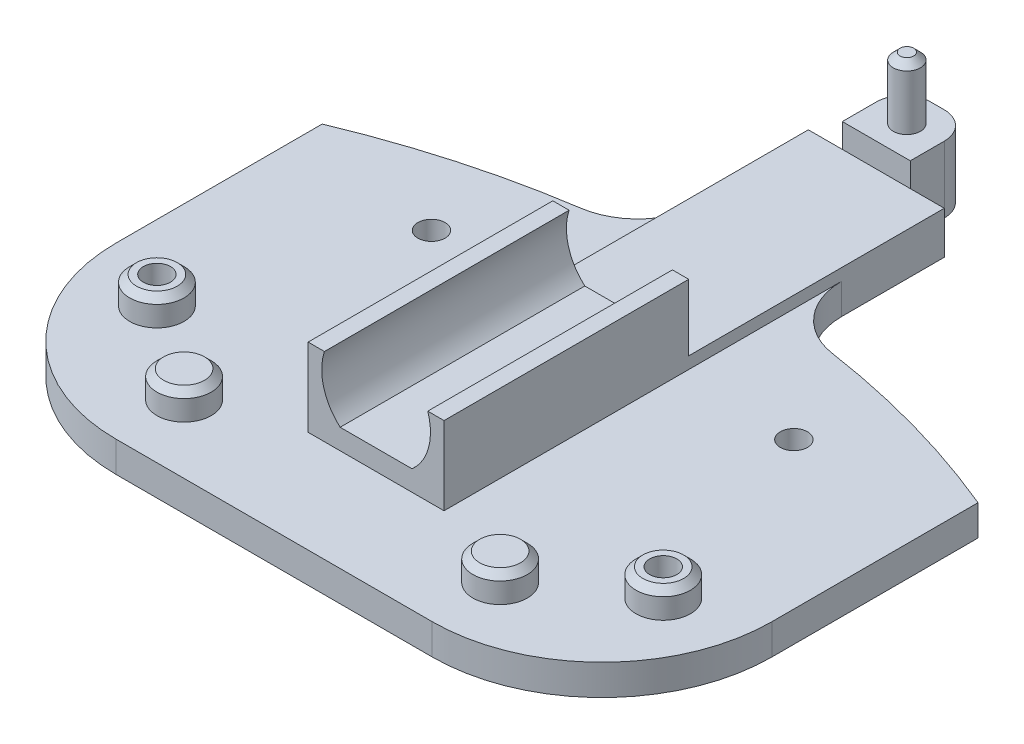
from build123d import *

# Parameters (mm, degrees)
SKETCH1_W           = 96.5
SKETCH1_H           = 110
BOSS_EXTRUDE1_DEPTH = 4.5
SKETCH2_R           = 4
BOSS_EXTRUDE2_DEPTH = 4
SKETCH3_R           = 2
BOSS_EXTRUDE3_DEPTH = 14.4
SKETCH4_W           = 20
SKETCH4_H           = 37.6
BOSS_EXTRUDE4_DEPTH = 1.75
BOSS_EXTRUDE5_DEPTH = 11.5
BOSS_EXTRUDE6_DEPTH = 5.3
CHAMFER2_SIZE       = 1
CUT_EXTRUDE6_DEPTH  = 115.67545509
CHAMFER3_SIZE       = 1
SKETCH2_4_R         = 4
BOSS_EXTRUDE8_DEPTH = 4
CUT_EXTRUDE10_DEPTH = 148.036084007
FILLET1_R           = 10
SKETCH21_R          = 2
CUT_EXTRUDE11_DEPTH = 148.036084007
CHAMFER4_SIZE       = 1
SKETCH22_R          = 2
CUT_EXTRUDE12_DEPTH = 147.698363999
FILLET2_R           = 25


with BuildPart() as part:
    # Sketch1 → Boss-Extrude1 (new body)
    with BuildSketch(Plane(origin=(0, 0, 0), x_dir=(1, 0, 0), z_dir=(0, 1, 0))):
        with Locations((48.25, -55)):
            Rectangle(SKETCH1_W, SKETCH1_H)
    extrude(amount=BOSS_EXTRUDE1_DEPTH)

    # Sketch2 → Boss-Extrude2 (add)
    with BuildSketch(Plane(origin=(0, 4.5, 0), x_dir=(1, 0, 0), z_dir=(0, 1, 0))):
        with Locations(Location((25, -100, 0), (0, 0, 270))):
            Circle(SKETCH2_R)
        with Locations(Location((71.5, -100, 0), (0, 0, 270))):
            Circle(SKETCH2_R)
    extrude(amount=BOSS_EXTRUDE2_DEPTH)

    # Sketch3 → Boss-Extrude3 (add)
    with BuildSketch(Plane(origin=(0, 4.5, 0), x_dir=(1, 0, 0), z_dir=(0, 1, 0))):
        with Locations(Location((48.25, -16.9, 0), (0, 0, 270))):
            Circle(SKETCH3_R)
    extrude(amount=BOSS_EXTRUDE3_DEPTH)

    # Sketch4 → Boss-Extrude4 (add)
    with BuildSketch(Plane(origin=(0, 4.5, 0), x_dir=(1, 0, 0), z_dir=(0, 1, 0))):
        with Locations((48.25, -40.2)):
            Rectangle(SKETCH4_W, SKETCH4_H)
    extrude(amount=BOSS_EXTRUDE4_DEPTH)

    # Sketch4<3> → Boss-Extrude5 (add)
    with BuildSketch(Plane(origin=(0, 4.5, 0), x_dir=(1, 0, 0), z_dir=(0, 1, 0))):
        Polygon((58.25, -59), (58.25, -95), (38.25, -95), (38.25, -59), (48.25, -59), align=None)
    extrude(amount=BOSS_EXTRUDE5_DEPTH)

    # Sketch4<5> → Boss-Extrude6 (add)
    with BuildSketch(Plane(origin=(0, 4.5, 0), x_dir=(1, 0, 0), z_dir=(0, 1, 0))):
        with BuildLine():
            Line((49.25, -12.4), (47.25, -12.4))
            ThreePointArc((47.25, -12.4), (44.421572875, -13.571572875), (43.25, -16.4))
            Line((43.25, -16.4), (43.25, -21.4))
            Line((43.25, -21.4), (53.25, -21.4))
            Line((53.25, -21.4), (53.25, -16.4))
            ThreePointArc((53.25, -16.4), (52.078427125, -13.571572875), (49.25, -12.4))
        make_face()
    extrude(amount=BOSS_EXTRUDE6_DEPTH)

    # Chamfer2
    chamfer2_edges = [part.edges().sort_by_distance(p)[0] for p in [
        (48.25, 18.9, 14.9),
    ]]
    chamfer(chamfer2_edges, length=CHAMFER2_SIZE)

    # Sketch9 → Cut-Extrude6 (cut, through all)
    with BuildSketch(Plane(origin=(0, 0, 59), x_dir=(-1, 0, 0), z_dir=(0, 0, -1))):
        with BuildLine():
            ThreePointArc((-55.849342077, 16), (-55.970490222, 11.403805654), (-53.541502622, 7.5))
            Line((-53.541502622, 7.5), (-42.958497378, 7.5))
            ThreePointArc((-42.958497378, 7.5), (-40.958497378, 10.208497378), (-40.25, 13.5))
            ThreePointArc((-40.25, 13.5), (-40.350799515, 14.765950905), (-40.650657923, 16))
            Line((-40.650657923, 16), (-55.849342077, 16))
        make_face()
    extrude(amount=-CUT_EXTRUDE6_DEPTH, mode=Mode.SUBTRACT)

    # Chamfer3
    chamfer3_edges = [part.edges().sort_by_distance(p)[0] for p in [
        (25, 8.5, 96),
        (71.5, 8.5, 96),
    ]]
    chamfer(chamfer3_edges, length=CHAMFER3_SIZE)

    # Sketch2<4> → Boss-Extrude8 (add)
    with BuildSketch(Plane(origin=(0, 4.5, 0), x_dir=(1, 0, 0), z_dir=(0, 1, 0))):
        with Locations(Location((11, -90, 0), (0, 0, 270))):
            Circle(SKETCH2_4_R)
        with Locations(Location((85.5, -90, 0), (0, 0, 270))):
            Circle(SKETCH2_4_R)
    extrude(amount=BOSS_EXTRUDE8_DEPTH)

    # Sketch20 → Cut-Extrude10 (cut, through all)
    with BuildSketch(Plane(origin=(0, 4.5, 0), x_dir=(1, 0, 0), z_dir=(0, 1, 0))):
        with BuildLine():
            Line((0, 0), (96.5, 0))
            Line((96.5, 0), (96.5, -54.687652439))
            ThreePointArc((96.5, -54.687652439), (77.742842614, -48.529130099), (58.25, -45.400642056))
            Line((58.25, -45.400642056), (58.25, -21.4))
            Line((58.25, -21.4), (53.25, -21.4))
            Line((53.25, -21.4), (53.25, -16.4))
            ThreePointArc((53.25, -16.4), (52.078427125, -13.571572875), (49.25, -12.4))
            Line((49.25, -12.4), (47.25, -12.4))
            ThreePointArc((47.25, -12.4), (44.421572875, -13.571572875), (43.25, -16.4))
            Line((43.25, -16.4), (43.25, -21.4))
            Line((43.25, -21.4), (38.25, -21.4))
            Line((38.25, -21.4), (38.25, -45.400642056))
            ThreePointArc((38.25, -45.400642056), (18.757157386, -48.529130099), (0, -54.687652439))
            Line((0, -54.687652439), (0, 0))
        make_face()
    extrude(amount=-CUT_EXTRUDE10_DEPTH, mode=Mode.SUBTRACT)

    # Fillet1
    fillet1_edges = [part.edges().sort_by_distance(p)[0] for p in [
        (58.25, 2.25, 45.400642056),
        (38.25, 2.25, 45.400642056),
    ]]
    fillet(fillet1_edges, radius=FILLET1_R)

    # Sketch21 → Cut-Extrude11 (cut, through all)
    with BuildSketch(Plane(origin=(0, 4.5, 0), x_dir=(1, 0, 0), z_dir=(0, 1, 0))):
        with Locations(Location((21.588470277, -60.190333609, 0), (0, 0, 270))):
            Circle(SKETCH21_R)
        with Locations(Location((74.911529723, -60.190333609, 0), (0, 0, 270))):
            Circle(SKETCH21_R)
    extrude(amount=-CUT_EXTRUDE11_DEPTH, mode=Mode.SUBTRACT)

    # Chamfer4
    chamfer4_edges = [part.edges().sort_by_distance(p)[0] for p in [
        (11, 8.5, 86),
        (85.5, 8.5, 86),
    ]]
    chamfer(chamfer4_edges, length=CHAMFER4_SIZE)

    # Sketch22 → Cut-Extrude12 (cut, through all)
    with BuildSketch(Plane(origin=(0, 8.5, 0), x_dir=(1, 0, 0), z_dir=(0, 1, 0))):
        with Locations(Location((11, -90, 0), (0, 0, 270))):
            Circle(SKETCH22_R)
        with Locations(Location((85.5, -90, 0), (0, 0, 270))):
            Circle(SKETCH22_R)
    extrude(amount=-CUT_EXTRUDE12_DEPTH, mode=Mode.SUBTRACT)

    # Fillet2
    fillet2_edges = [part.edges().sort_by_distance(p)[0] for p in [
        (96.5, 2.25, 110),
        (0, 2.25, 110),
    ]]
    fillet(fillet2_edges, radius=FILLET2_R)


solid = part.part
